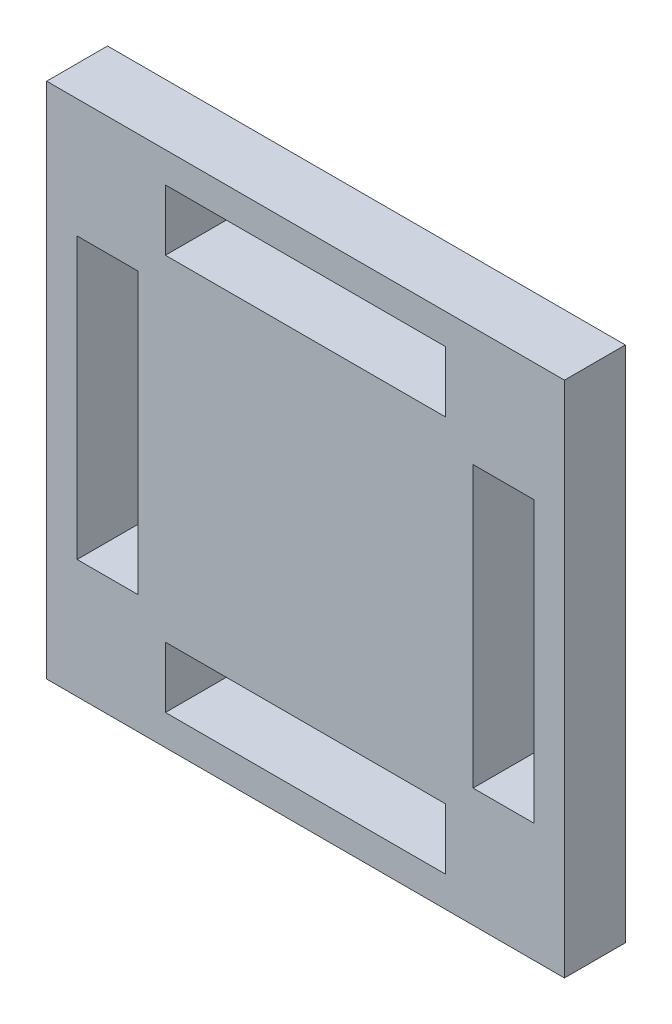
from build123d import *

# Parameters (mm, degrees)
SKETCH_1_W          = 75
SKETCH_1_H          = 75
EXTRUDE_1_DEPTH     = 15
SKETCH_6_R          = 17.5
CUT_EXTRUDE_7_DEPTH = 1
SKETCH_7_W          = 75
SKETCH_7_H          = 75
SKETCH_7_W_2        = 55
SKETCH_7_H_2        = 55
CUT_EXTRUDE_8_DEPTH = 5
SKETCH_8_W          = 10
SKETCH_8_H          = 46
SKETCH_8_W_2        = 46
SKETCH_8_H_2        = 10
CUT_EXTRUDE_9_DEPTH = 54.967582862
SKETCH_9_W          = 85
SKETCH_9_H          = 85
SKETCH_9_W_2        = 75
SKETCH_9_H_2        = 75
EXTRUDE_2_DEPTH     = 10


with BuildPart() as part:
    # ｽｹｯﾁ1 → ﾎﾞｽ - 押し出し1 (new body)
    with BuildSketch(Plane.XY):
        Rectangle(SKETCH_1_W, SKETCH_1_H)
    extrude(amount=EXTRUDE_1_DEPTH)

    # ｽｹｯﾁ6 → ｶｯﾄ - 押し出し7 (cut)
    with BuildSketch(Plane(origin=(0, 0, 0), x_dir=(-1, 0, 0), z_dir=(0, 0, -1))):
        Circle(SKETCH_6_R)
    extrude(amount=-CUT_EXTRUDE_7_DEPTH, mode=Mode.SUBTRACT)

    # ｽｹｯﾁ7 → ｶｯﾄ - 押し出し8 (cut)
    with BuildSketch(Plane(origin=(0, 0, 0), x_dir=(-1, 0, 0), z_dir=(0, 0, -1))):
        Rectangle(SKETCH_7_W, SKETCH_7_H)
        Rectangle(SKETCH_7_W_2, SKETCH_7_H_2, mode=Mode.SUBTRACT)
    extrude(amount=-CUT_EXTRUDE_8_DEPTH, mode=Mode.SUBTRACT)

    # ｽｹｯﾁ8 → ｶｯﾄ - 押し出し9 (cut, through all)
    with BuildSketch(Plane(origin=(0, 0, 5), x_dir=(-1, 0, 0), z_dir=(0, 0, -1))):
        with Locations((-32.5, 0)):
            Rectangle(SKETCH_8_W, SKETCH_8_H)
        with Locations((32.5, 0)):
            Rectangle(SKETCH_8_W, SKETCH_8_H)
        with Locations((0, -32.5)):
            Rectangle(SKETCH_8_W_2, SKETCH_8_H_2)
        with Locations((0, 32.5)):
            Rectangle(SKETCH_8_W_2, SKETCH_8_H_2)
    extrude(amount=-CUT_EXTRUDE_9_DEPTH, mode=Mode.SUBTRACT)

    # ｽｹｯﾁ9 → ﾎﾞｽ - 押し出し2 (add)
    with BuildSketch(Plane(origin=(0, 0, 5), x_dir=(-1, 0, 0), z_dir=(0, 0, -1))):
        Rectangle(SKETCH_9_W, SKETCH_9_H)
        Rectangle(SKETCH_9_W_2, SKETCH_9_H_2, mode=Mode.SUBTRACT)
    extrude(amount=-EXTRUDE_2_DEPTH)


solid = part.part
